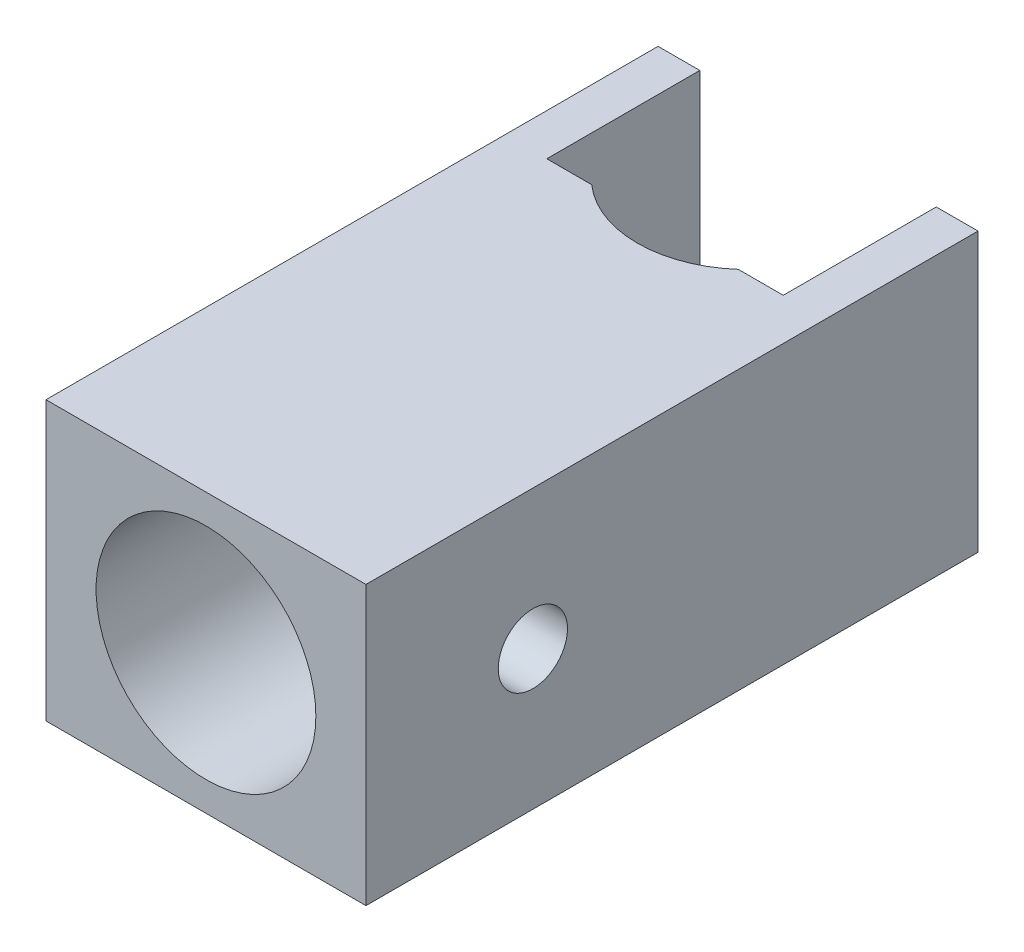
from build123d import *

# Parameters (mm, degrees)
SKETCH1_W               = 11.5
SKETCH1_H               = 10
SKETCH1_R               = 3.95
BOSS_EXTRUDE1_DEPTH     = 10
SKETCH2_W               = 11.5
SKETCH2_H               = 10
BOSS_EXTRUDE2_DEPTH     = 12
CUT_EXTRUDE1_DEPTH      = 4.25
CUT_EXTRUDE1_DEPTH_BACK = 4.25
SKETCH4_R               = 1.245
CUT_EXTRUDE2_DEPTH      = 18.356554958
CUT_EXTRUDE3_DEPTH      = 17.645194536


with BuildPart() as part:
    # Sketch1 → Boss-Extrude1 (new body)
    with BuildSketch(Plane.XY):
        Rectangle(SKETCH1_W, SKETCH1_H)
        Circle(SKETCH1_R, mode=Mode.SUBTRACT)
    extrude(amount=BOSS_EXTRUDE1_DEPTH)

    # Sketch2 → Boss-Extrude2 (add)
    with BuildSketch(Plane(origin=(0, 0, 0), x_dir=(-1, 0, 0), z_dir=(0, 0, -1))):
        Rectangle(SKETCH2_W, SKETCH2_H)
    extrude(amount=BOSS_EXTRUDE2_DEPTH)

    # Sketch3 → Cut-Extrude1 (cut, two sides: drawn at the far end of the back side and taken through both)
    with BuildSketch(Plane.ZY.offset(-CUT_EXTRUDE1_DEPTH_BACK)):
        with BuildLine():
            Line((-12, -5), (-3.5, -5))
            Line((-3.5, -5), (-3.5, 1.707151991))
            ThreePointArc((-3.5, 1.707151991), (-4.392121597, 3.756542144), (-6.5, 4.5))
            Line((-6.5, 4.5), (-6.5, 5))
            Line((-6.5, 5), (-12, 5))
            Line((-12, 5), (-12, -5))
        make_face()
    extrude(amount=CUT_EXTRUDE1_DEPTH + CUT_EXTRUDE1_DEPTH_BACK, mode=Mode.SUBTRACT)

    # Sketch4 → Cut-Extrude2 (cut, through all)
    with BuildSketch(Plane.ZY.offset(5.75)):
        with Locations((4, 0)):
            Circle(SKETCH4_R)
    extrude(amount=-CUT_EXTRUDE2_DEPTH, mode=Mode.SUBTRACT)

    # Sketch5 → Cut-Extrude3 (cut, through all)
    with BuildSketch(Plane(origin=(0, 5, 0), x_dir=(1, 0, 0), z_dir=(0, 1, 0))):
        with BuildLine():
            ThreePointArc((-2.633913438, 6.5), (-1.408678459, 5.758412878), (0, 5.5))
            Line((0, 5.5), (0, 6.5))
            Line((0, 6.5), (-2.633913438, 6.5))
        make_face()
        with BuildLine():
            Line((0, 6.5), (0, 5.5))
            ThreePointArc((0, 5.5), (1.408678459, 5.758412878), (2.633913438, 6.5))
            Line((2.633913438, 6.5), (0, 6.5))
        make_face()
        with BuildLine():
            Line((-2.633913438, 6.5), (0, 6.5))
            Line((0, 6.5), (2.633913438, 6.5))
            ThreePointArc((2.633913438, 6.5), (3.61969063, 7.841231551), (3.96875, 9.46875))
            ThreePointArc((3.96875, 9.46875), (-1.627518449, 13.08844063), (-2.633913438, 6.5))
        make_face()
    extrude(amount=-CUT_EXTRUDE3_DEPTH, mode=Mode.SUBTRACT)


solid = part.part
